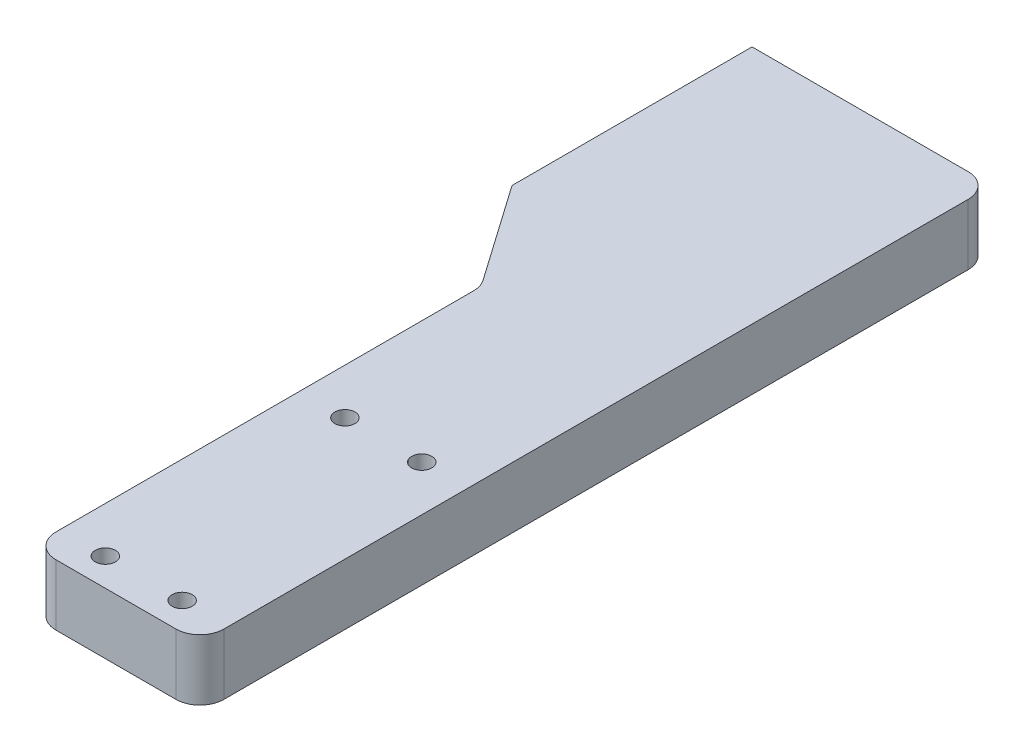
from build123d import *

# Parameters (mm, degrees)
SKETCH12_W                = 50
SKETCH12_H                = 12.7
BOSS_EXTRUDE1_DEPTH       = 112
M5X0_8_TAPPED_HOLE3_D     = 4.2
SKETCH19_W                = 50
SKETCH19_H                = 12.7
BOSS_EXTRUDE2_DEPTH       = 53
M5X0_8_TAPPED_HOLE4_D     = 4.2
M5X0_8_TAPPED_HOLE4_DEPTH = 20
M5X0_8_TAPPED_HOLE4_TIP   = 1.2618073
CUT_EXTRUDE1_DEPTH        = 116.456875066
SKETCH26_3_W              = 18
SKETCH26_3_H              = 93.3
SKETCH26_3_W_2            = 19
SKETCH26_3_H_2            = 33.9
CUT_EXTRUDE2_DEPTH        = 9.7
FILLET1_R                 = 5


with BuildPart() as part:
    # Sketch12 → Boss-Extrude1 (new body)
    with BuildSketch(Plane.XY):
        Rectangle(SKETCH12_W, SKETCH12_H)
    extrude(amount=BOSS_EXTRUDE1_DEPTH)

    # M5x0.8 Tapped Hole3 (through all)
    with Locations(Plane(origin=(0, 6.35, 0), x_dir=(1, 0, 0), z_dir=(0, 1, 0))):
        with Locations((-0.5, -56.3), (15.5, -56.3), (15.5, -106.2), (-0.5, -106.2)):
            Hole(M5X0_8_TAPPED_HOLE3_D / 2)

    # Sketch19 → Boss-Extrude2 (add)
    with BuildSketch(Plane(origin=(0, 0, 0), x_dir=(-1, 0, 0), z_dir=(0, 0, -1))):
        Rectangle(SKETCH19_W, SKETCH19_H)
    extrude(amount=BOSS_EXTRUDE2_DEPTH)

    # M5x0.8 Tapped Hole4
    with Locations(Plane.ZY.offset(25)):
        with Locations((-37, 0), (-19, 0)):
            Hole(M5X0_8_TAPPED_HOLE4_D / 2, depth=M5X0_8_TAPPED_HOLE4_DEPTH)
            with Locations((0, 0, -(M5X0_8_TAPPED_HOLE4_DEPTH + M5X0_8_TAPPED_HOLE4_TIP / 2))):  # 118° drill point
                Cone(0, M5X0_8_TAPPED_HOLE4_D / 2, M5X0_8_TAPPED_HOLE4_TIP, mode=Mode.SUBTRACT)

    # Sketch26 → Cut-Extrude1 (cut, through all)
    with BuildSketch(Plane.XZ.offset(6.35)):
        Polygon((-10, 18.422220101), (-10, 112), (-25, 112), (-25, -3), align=None)
    extrude(amount=-CUT_EXTRUDE1_DEPTH, mode=Mode.SUBTRACT)

    # Sketch26<3> → Cut-Extrude2 (cut)
    with BuildSketch(Plane.XZ.offset(6.35)):
        with Locations((8, 1.65)):
            Rectangle(SKETCH26_3_W, SKETCH26_3_H)
        with Locations((7.5, 81.25)):
            Rectangle(SKETCH26_3_W_2, SKETCH26_3_H_2)
    extrude(amount=-CUT_EXTRUDE2_DEPTH, mode=Mode.SUBTRACT)

    # Fillet1
    fillet1_edges = [part.edges().sort_by_distance(p)[0] for p in [
        (25, 0, -53),
        (-10, 0, 18.422220101),
        (25, 0, 112),
        (-10, 0, 112),
        (-2, -1.5, 98.2),
        (17, -1.5, 98.2),
        (17, -1.5, 64.3),
        (-2, -1.5, 64.3),
        (-1, -1.5, -45),
        (17, -1.5, -45),
        (-1, -1.5, 48.3),
        (17, -1.5, 48.3),
    ]]
    fillet(fillet1_edges, radius=FILLET1_R)


solid = part.part
